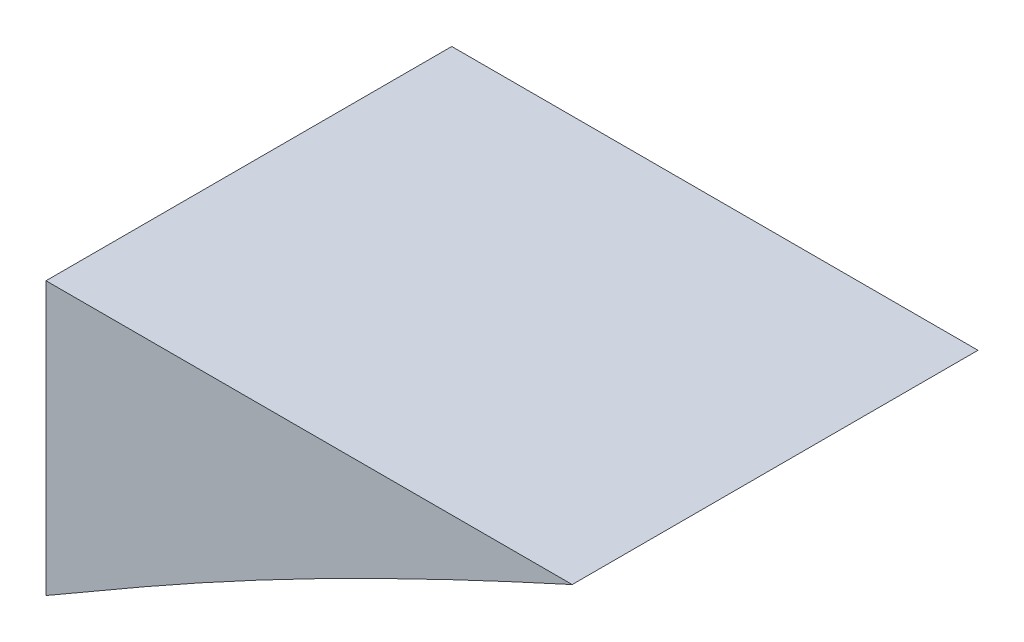
from build123d import *

# Parameters (mm, degrees)
FEATURE_PRISM_DEPTH = 8
PROFILE_CUT_W       = 11.625
PROFILE_CUT_H       = 14
FEATURE_TRIM_DEPTH  = 24.748684334


with BuildPart() as part:
    # profile:cubic → feature:prism (new body)
    with BuildSketch(Plane.XY):
        with BuildLine():
            Line((20, 10), (0, 10))
            Line((0, 10), (0, 0))
            add(Edge.make_bspline(
                [(0, 0), (10, 4), (9, 5), (20, 10)],
                knots=[0, 0, 0, 0, 1, 1, 1, 1], degree=3))
        make_face()
    extrude(amount=FEATURE_PRISM_DEPTH)

    # profile:cut → feature:trim (cut, through all)
    with BuildSketch(Plane.XY):
        with Locations((3.8125, 5)):
            Rectangle(PROFILE_CUT_W, PROFILE_CUT_H)
    extrude(amount=FEATURE_TRIM_DEPTH, mode=Mode.SUBTRACT)


solid = part.part
